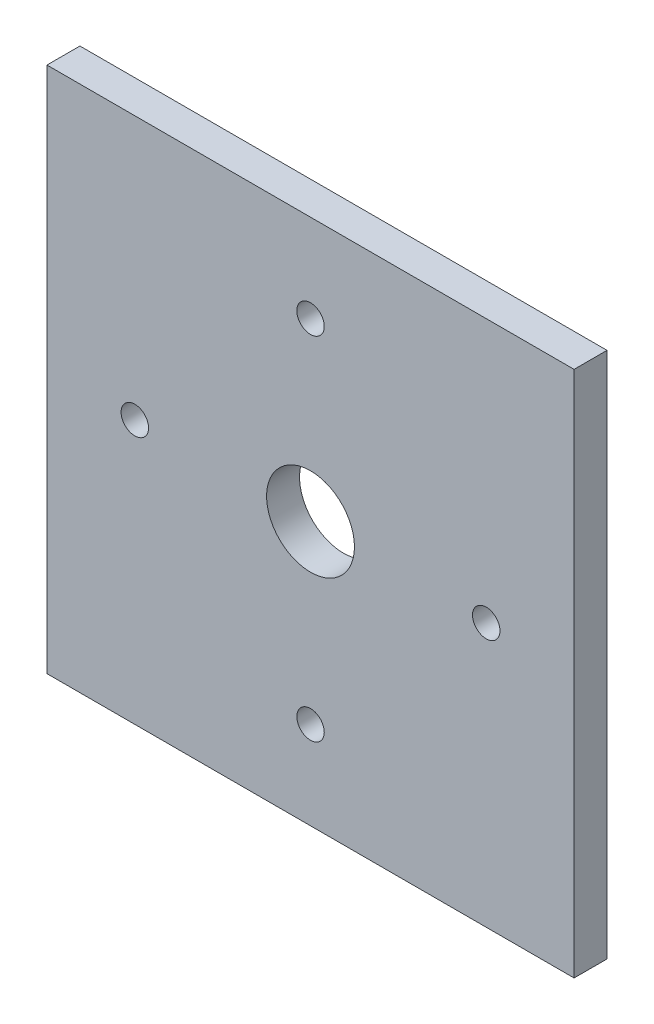
from build123d import *

# Parameters (mm, degrees)
SKETCH1_W             = 152.4
SKETCH1_H             = 152.4
PLATE_DEPTH           = 9.525
SKETCH3_R             = 3.96875
BOLT_ONE_SKETCH_DEPTH = 216.736518988
SKETCH4_R             = 12.7
CENTRE_BORE2_DEPTH    = 216.736518988


with BuildPart() as part:
    # Sketch1 → plate (new body)
    with BuildSketch(Plane.XY):
        with Locations((76.2, 76.2)):
            Rectangle(SKETCH1_W, SKETCH1_H)
    extrude(amount=PLATE_DEPTH)

    # Sketch3 → bolt_one_sketch (cut, through all)
    with BuildSketch(Plane.XY):
        with Locations((127, 76.2)):
            Circle(SKETCH3_R)
        with Locations((76.2, 127)):
            Circle(SKETCH3_R)
        with Locations((25.4, 76.2)):
            Circle(SKETCH3_R)
        with Locations((76.2, 25.4)):
            Circle(SKETCH3_R)
    extrude(amount=BOLT_ONE_SKETCH_DEPTH, mode=Mode.SUBTRACT)

    # Sketch4 → centre_bore2 (cut, through all)
    with BuildSketch(Plane.XY):
        with Locations((76.2, 76.2)):
            Circle(SKETCH4_R)
    extrude(amount=CENTRE_BORE2_DEPTH, mode=Mode.SUBTRACT)


solid = part.part
